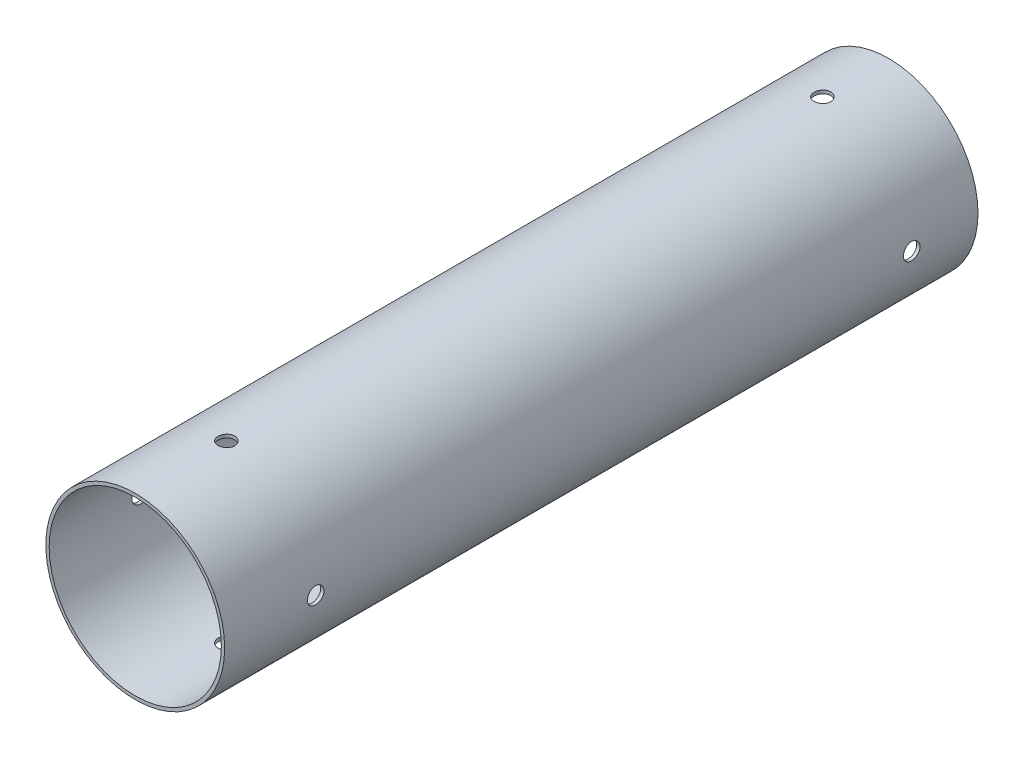
from build123d import *

# Parameters (mm, degrees)
SKETCH1_R                      = 27
SKETCH1_R_2                    = 26
BOSS_EXTRUDE1_DEPTH            = 227.5
CUT_EXTRUDE1_REACH             = 232.682
SKETCH2_R                      = 2.5
CUT_EXTRUDE1_DIRECTION_2_DEPTH = 1
LPATTERN1_COUNT                = 2
LPATTERN1_PITCH                = 180
CIRPATTERN2_COPY_1_REACH       = 232.682
CIRPATTERN2_COPY_1_SKETCH_R    = 2.5
CIRPATTERN2_COPY_2_REACH       = 232.682
CIRPATTERN2_COPY_2_SKETCH_R    = 2.5
CIRPATTERN2_COPY_3_REACH       = 232.682
CIRPATTERN2_COPY_3_SKETCH_R    = 2.5
CIRPATTERN2_COPY_4_SKETCH_R    = 2.5
CIRPATTERN2_COPY_4_DEPTH       = 1
CIRPATTERN2_COPY_5_SKETCH_R    = 2.5
CIRPATTERN2_COPY_5_DEPTH       = 1
CIRPATTERN2_COPY_6_SKETCH_R    = 2.5
CIRPATTERN2_COPY_6_DEPTH       = 1
CIRPATTERN2_COPY_7_REACH       = 232.682
CIRPATTERN2_COPY_7_SKETCH_R    = 2.5
CIRPATTERN2_COPY_8_REACH       = 232.682
CIRPATTERN2_COPY_8_SKETCH_R    = 2.5
CIRPATTERN2_COPY_9_REACH       = 232.682
CIRPATTERN2_COPY_9_SKETCH_R    = 2.5
CIRPATTERN2_COPY_10_SKETCH_R   = 2.5
CIRPATTERN2_COPY_10_DEPTH      = 1
CIRPATTERN2_COPY_11_SKETCH_R   = 2.5
CIRPATTERN2_COPY_11_DEPTH      = 1
CIRPATTERN2_COPY_12_SKETCH_R   = 2.5
CIRPATTERN2_COPY_12_DEPTH      = 1


with BuildPart() as part:
    # Sketch1 → Boss-Extrude1 (new body)
    with BuildSketch(Plane.XY):
        Circle(SKETCH1_R)
        Circle(SKETCH1_R_2, mode=Mode.SUBTRACT)
    extrude(amount=BOSS_EXTRUDE1_DEPTH)

    # Sketch2 → Cut-Extrude1 (cut, up to next)
    with BuildSketch(Plane(origin=(0, 0, 0), x_dir=(1, 0, 0), z_dir=(0, 1, 0)), mode=Mode.PRIVATE) as cut_extrude1_sk1:
        with Locations((0, -20)):
            Circle(SKETCH2_R)
    cut_extrude1_tool1 = extrude(cut_extrude1_sk1.sketch, amount=-CUT_EXTRUDE1_REACH, mode=Mode.PRIVATE) & part.part
    cut_extrude1 = cut_extrude1_tool1.solids().sort_by_distance((0, 0, 20))[0]
    add(cut_extrude1, mode=Mode.SUBTRACT)

    # Sketch2 → Cut-Extrude1 direction 2 (cut)
    with BuildSketch(Plane(origin=(0, 0, 0), x_dir=(1, 0, 0), z_dir=(0, 1, 0))):
        with Locations((0, -20)):
            Circle(SKETCH2_R)
    cut_extrude1_direction_2 = extrude(amount=CUT_EXTRUDE1_DIRECTION_2_DEPTH, mode=Mode.SUBTRACT)

    # LPattern1: Cut-Extrude1, Cut-Extrude1 direction 2 ×2
    with Locations(*[(0, 0, i * LPATTERN1_PITCH) for i in range(1, LPATTERN1_COUNT)]):
        add(cut_extrude1, mode=Mode.SUBTRACT)
        add(cut_extrude1_direction_2, mode=Mode.SUBTRACT)

    # CirPattern2 copy 1 sketch → CirPattern2 copy 1 (cut, up to next)
    with BuildSketch(Plane(origin=(0, 0, 180), x_dir=(0, -1, 0), z_dir=(1, 0, 0)), mode=Mode.PRIVATE) as cirpattern2_copy_1_sk1:
        with Locations((0, -20)):
            Circle(CIRPATTERN2_COPY_1_SKETCH_R)
    cirpattern2_copy_1_tool1 = extrude(cirpattern2_copy_1_sk1.sketch, amount=-CIRPATTERN2_COPY_1_REACH, mode=Mode.PRIVATE) & part.part
    add(cirpattern2_copy_1_tool1.solids().sort_by_distance((0, 0, 200))[0], mode=Mode.SUBTRACT)

    # CirPattern2 copy 2 sketch → CirPattern2 copy 2 (cut, up to next)
    with BuildSketch(Plane(origin=(0, 0, 180), x_dir=(-1, 0, 0), z_dir=(0, -1, 0)), mode=Mode.PRIVATE) as cirpattern2_copy_2_sk1:
        with Locations((0, -20)):
            Circle(CIRPATTERN2_COPY_2_SKETCH_R)
    cirpattern2_copy_2_tool1 = extrude(cirpattern2_copy_2_sk1.sketch, amount=-CIRPATTERN2_COPY_2_REACH, mode=Mode.PRIVATE) & part.part
    add(cirpattern2_copy_2_tool1.solids().sort_by_distance((0, 0, 200))[0], mode=Mode.SUBTRACT)

    # CirPattern2 copy 3 sketch → CirPattern2 copy 3 (cut, up to next)
    with BuildSketch(Plane(origin=(0, 0, 180), x_dir=(0, 1, 0), z_dir=(-1, 0, 0)), mode=Mode.PRIVATE) as cirpattern2_copy_3_sk1:
        with Locations((0, -20)):
            Circle(CIRPATTERN2_COPY_3_SKETCH_R)
    cirpattern2_copy_3_tool1 = extrude(cirpattern2_copy_3_sk1.sketch, amount=-CIRPATTERN2_COPY_3_REACH, mode=Mode.PRIVATE) & part.part
    add(cirpattern2_copy_3_tool1.solids().sort_by_distance((0, 0, 200))[0], mode=Mode.SUBTRACT)

    # CirPattern2 copy 4 sketch → CirPattern2 copy 4 (cut)
    with BuildSketch(Plane(origin=(0, 0, 180), x_dir=(0, -1, 0), z_dir=(1, 0, 0))):
        with Locations((0, -20)):
            Circle(CIRPATTERN2_COPY_4_SKETCH_R)
    extrude(amount=CIRPATTERN2_COPY_4_DEPTH, mode=Mode.SUBTRACT)

    # CirPattern2 copy 5 sketch → CirPattern2 copy 5 (cut)
    with BuildSketch(Plane(origin=(0, 0, 180), x_dir=(-1, 0, 0), z_dir=(0, -1, 0))):
        with Locations((0, -20)):
            Circle(CIRPATTERN2_COPY_5_SKETCH_R)
    extrude(amount=CIRPATTERN2_COPY_5_DEPTH, mode=Mode.SUBTRACT)

    # CirPattern2 copy 6 sketch → CirPattern2 copy 6 (cut)
    with BuildSketch(Plane(origin=(0, 0, 180), x_dir=(0, 1, 0), z_dir=(-1, 0, 0))):
        with Locations((0, -20)):
            Circle(CIRPATTERN2_COPY_6_SKETCH_R)
    extrude(amount=CIRPATTERN2_COPY_6_DEPTH, mode=Mode.SUBTRACT)

    # CirPattern2 copy 7 sketch → CirPattern2 copy 7 (cut, up to next)
    with BuildSketch(Plane(origin=(0, 0, 0), x_dir=(0, -1, 0), z_dir=(1, 0, 0)), mode=Mode.PRIVATE) as cirpattern2_copy_7_sk1:
        with Locations((0, -20)):
            Circle(CIRPATTERN2_COPY_7_SKETCH_R)
    cirpattern2_copy_7_tool1 = extrude(cirpattern2_copy_7_sk1.sketch, amount=-CIRPATTERN2_COPY_7_REACH, mode=Mode.PRIVATE) & part.part
    add(cirpattern2_copy_7_tool1.solids().sort_by_distance((0, 0, 20))[0], mode=Mode.SUBTRACT)

    # CirPattern2 copy 8 sketch → CirPattern2 copy 8 (cut, up to next)
    with BuildSketch(Plane(origin=(0, 0, 0), x_dir=(-1, 0, 0), z_dir=(0, -1, 0)), mode=Mode.PRIVATE) as cirpattern2_copy_8_sk1:
        with Locations((0, -20)):
            Circle(CIRPATTERN2_COPY_8_SKETCH_R)
    cirpattern2_copy_8_tool1 = extrude(cirpattern2_copy_8_sk1.sketch, amount=-CIRPATTERN2_COPY_8_REACH, mode=Mode.PRIVATE) & part.part
    add(cirpattern2_copy_8_tool1.solids().sort_by_distance((0, 0, 20))[0], mode=Mode.SUBTRACT)

    # CirPattern2 copy 9 sketch → CirPattern2 copy 9 (cut, up to next)
    with BuildSketch(Plane(origin=(0, 0, 0), x_dir=(0, 1, 0), z_dir=(-1, 0, 0)), mode=Mode.PRIVATE) as cirpattern2_copy_9_sk1:
        with Locations((0, -20)):
            Circle(CIRPATTERN2_COPY_9_SKETCH_R)
    cirpattern2_copy_9_tool1 = extrude(cirpattern2_copy_9_sk1.sketch, amount=-CIRPATTERN2_COPY_9_REACH, mode=Mode.PRIVATE) & part.part
    add(cirpattern2_copy_9_tool1.solids().sort_by_distance((0, 0, 20))[0], mode=Mode.SUBTRACT)

    # CirPattern2 copy 10 sketch → CirPattern2 copy 10 (cut)
    with BuildSketch(Plane(origin=(0, 0, 0), x_dir=(0, -1, 0), z_dir=(1, 0, 0))):
        with Locations((0, -20)):
            Circle(CIRPATTERN2_COPY_10_SKETCH_R)
    extrude(amount=CIRPATTERN2_COPY_10_DEPTH, mode=Mode.SUBTRACT)

    # CirPattern2 copy 11 sketch → CirPattern2 copy 11 (cut)
    with BuildSketch(Plane(origin=(0, 0, 0), x_dir=(-1, 0, 0), z_dir=(0, -1, 0))):
        with Locations((0, -20)):
            Circle(CIRPATTERN2_COPY_11_SKETCH_R)
    extrude(amount=CIRPATTERN2_COPY_11_DEPTH, mode=Mode.SUBTRACT)

    # CirPattern2 copy 12 sketch → CirPattern2 copy 12 (cut)
    with BuildSketch(Plane(origin=(0, 0, 0), x_dir=(0, 1, 0), z_dir=(-1, 0, 0))):
        with Locations((0, -20)):
            Circle(CIRPATTERN2_COPY_12_SKETCH_R)
    extrude(amount=CIRPATTERN2_COPY_12_DEPTH, mode=Mode.SUBTRACT)


solid = part.part
